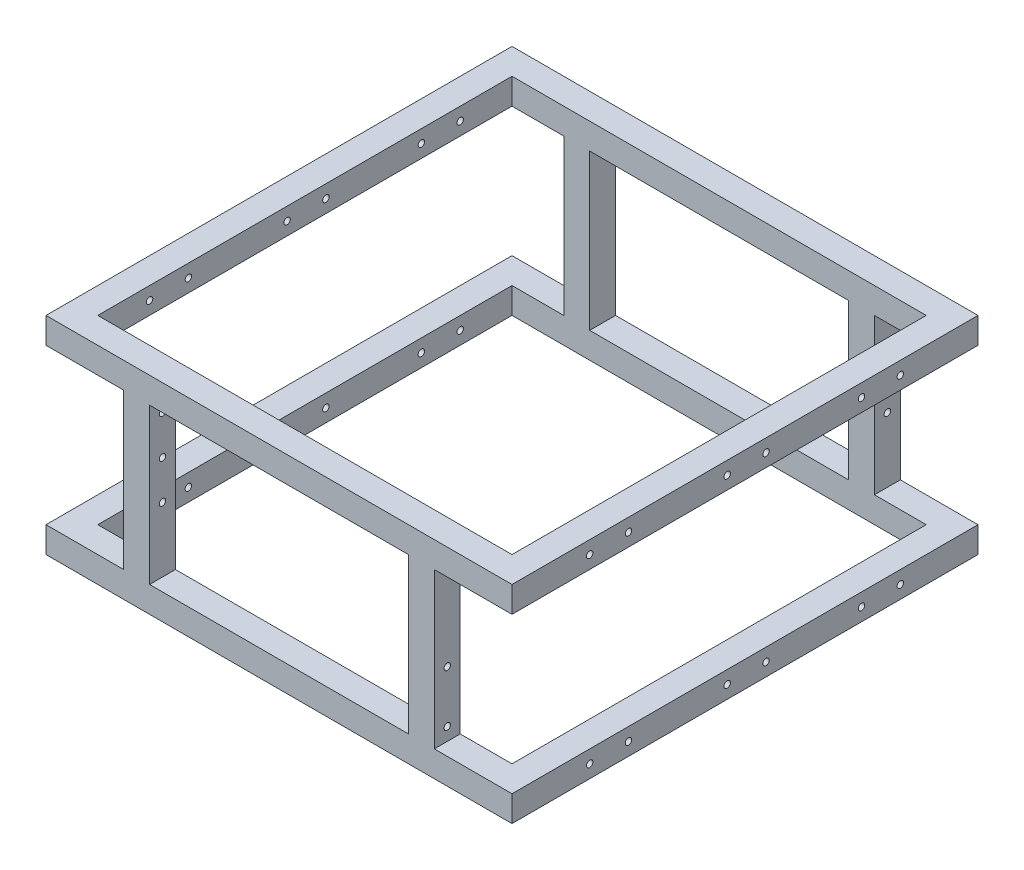
from build123d import *

# Parameters (mm, degrees)
SKETCH1_W            = 457.2
SKETCH1_H            = 457.2
SKETCH1_W_2          = 406.4
SKETCH1_H_2          = 406.4
BOSS_EXTRUDE1_DEPTH  = 203.2
CUT_EXTRUDE3_REACH   = 552.073
SKETCH2_W            = 254
SKETCH2_H            = 152.4
SKETCH2_W_2          = 76.2
SKETCH4_W            = 215.9
SKETCH4_H            = 152.4
CUT_EXTRUDE4_DEPTH   = 25.4
SKETCH6_R            = 3.175
CUT_EXTRUDE5_DEPTH   = 25.4
CUT_EXTRUDE6_START   = -25.4
SKETCH7_R            = 3.175
CUT_EXTRUDE6_DEPTH   = 25.4
CUT_EXTRUDE7_REACH   = 552.073
SKETCH8_R            = 3.175
SKETCH10_R           = 3.175
CUT_EXTRUDE8_DEPTH   = 551.072758824
LPATTERN1_COUNT      = 2
LPATTERN1_PITCH      = 38.1
LPATTERN1_COUNT_DIR2 = 2
LPATTERN1_PITCH_DIR2 = 177.8
SKETCH12_W           = 25.4
SKETCH12_H           = 152.4
CUT_EXTRUDE9_DEPTH   = 25.4
SKETCH13_W           = 25.4
SKETCH13_H           = 152.4
BOSS_EXTRUDE2_DEPTH  = 25.4
SKETCH14_R           = 3.175
CUT_EXTRUDE11_DEPTH  = 25.4


with BuildPart() as part:
    # Sketch1 → Boss-Extrude1 (new body)
    with BuildSketch(Plane(origin=(0, 0, 0), x_dir=(1, 0, 0), z_dir=(0, 1, 0))):
        Rectangle(SKETCH1_W, SKETCH1_H)
        Rectangle(SKETCH1_W_2, SKETCH1_H_2, mode=Mode.SUBTRACT)
    extrude(amount=BOSS_EXTRUDE1_DEPTH)

    # Cut-Extrude3: up to this face of the body (flat: up to its plane)
    cut_extrude3_end = Plane(part.part.faces().sort_by_distance((0, 101.6, -203.2))[0])
    # Sketch2 → Cut-Extrude3 (cut, up to the picked face)
    with BuildSketch(Plane.XY.offset(228.6), mode=Mode.PRIVATE) as cut_extrude3_sk1:
        with Locations((0, 101.6)):
            Rectangle(SKETCH2_W, SKETCH2_H)
    cut_extrude3_tool1 = split(extrude(cut_extrude3_sk1.sketch, amount=-CUT_EXTRUDE3_REACH, mode=Mode.PRIVATE), bisect_by=cut_extrude3_end, keep=Keep.BOTH, mode=Mode.PRIVATE)
    # Sketch2 → Cut-Extrude3 (cut, up to the picked face)
    with BuildSketch(Plane.XY.offset(228.6), mode=Mode.PRIVATE) as cut_extrude3_sk2:
        with Locations((190.5, 101.6)):
            Rectangle(SKETCH2_W_2, SKETCH2_H)
    cut_extrude3_tool2 = split(extrude(cut_extrude3_sk2.sketch, amount=-CUT_EXTRUDE3_REACH, mode=Mode.PRIVATE), bisect_by=cut_extrude3_end, keep=Keep.BOTH, mode=Mode.PRIVATE)
    # Sketch2 → Cut-Extrude3 (cut, up to the picked face)
    with BuildSketch(Plane.XY.offset(228.6), mode=Mode.PRIVATE) as cut_extrude3_sk3:
        with Locations((-190.5, 101.6)):
            Rectangle(SKETCH2_W_2, SKETCH2_H)
    cut_extrude3_tool3 = split(extrude(cut_extrude3_sk3.sketch, amount=-CUT_EXTRUDE3_REACH, mode=Mode.PRIVATE), bisect_by=cut_extrude3_end, keep=Keep.BOTH, mode=Mode.PRIVATE)
    add(cut_extrude3_tool1.solids().sort_by(Axis((0, 101.6, 228.6), (0, 0, -1)))[0], mode=Mode.SUBTRACT)
    add(cut_extrude3_tool2.solids().sort_by(Axis((190.5, 101.6, 228.6), (0, 0, -1)))[0], mode=Mode.SUBTRACT)
    add(cut_extrude3_tool3.solids().sort_by(Axis((-190.5, 101.6, 228.6), (0, 0, -1)))[0], mode=Mode.SUBTRACT)

    # Sketch4 → Cut-Extrude4 (cut)
    with BuildSketch(Plane(origin=(0, 0, -228.6), x_dir=(-1, 0, 0), z_dir=(0, 0, -1))):
        with Locations((120.65, 101.6)):
            Rectangle(SKETCH4_W, SKETCH4_H)
        with Locations((-120.65, 101.6)):
            Rectangle(SKETCH4_W, SKETCH4_H)
    extrude(amount=-CUT_EXTRUDE4_DEPTH, mode=Mode.SUBTRACT)

    # Sketch6 → Cut-Extrude5 (cut)
    with BuildSketch(Plane(origin=(152.4, 0, 0), x_dir=(0, 0, -1), z_dir=(1, 0, 0))):
        with Locations(Location((-215.9, 38.1, 0), (0, 0, 90))):
            Circle(SKETCH6_R)
        with Locations(Location((-215.9, 88.9, 0), (0, 0, 90))):
            Circle(SKETCH6_R)
    extrude(amount=-CUT_EXTRUDE5_DEPTH, mode=Mode.SUBTRACT)

    # Sketch7 → Cut-Extrude6 (cut)
    with BuildSketch(Plane.ZY.offset(152.4).offset(CUT_EXTRUDE6_START)):
        with Locations((215.9, 165.1)):
            Circle(SKETCH7_R)
        with Locations((215.9, 127)):
            Circle(SKETCH7_R)
        with Locations(Location((215.9, 88.9, 0), (0, 0, 90))):
            Circle(SKETCH7_R)
    extrude(amount=CUT_EXTRUDE6_DEPTH, mode=Mode.SUBTRACT)

    # Cut-Extrude7: up to this face of the body (flat: up to its plane)
    cut_extrude7_end = Plane(part.part.faces().sort_by_distance((-228.6, 190.5, 0))[0])
    # Sketch8 → Cut-Extrude7 (cut, up to the picked face)
    with BuildSketch(Plane(origin=(228.6, 0, 0), x_dir=(0, 0, -1), z_dir=(1, 0, 0)), mode=Mode.PRIVATE) as cut_extrude7_sk1:
        with Locations((152.4, 190.5)):
            Circle(SKETCH8_R)
    cut_extrude7_tool1 = split(extrude(cut_extrude7_sk1.sketch, amount=-CUT_EXTRUDE7_REACH, mode=Mode.PRIVATE), bisect_by=cut_extrude7_end, keep=Keep.BOTH, mode=Mode.PRIVATE)
    # Sketch8 → Cut-Extrude7 (cut, up to the picked face)
    with BuildSketch(Plane(origin=(228.6, 0, 0), x_dir=(0, 0, -1), z_dir=(1, 0, 0)), mode=Mode.PRIVATE) as cut_extrude7_sk2:
        with Locations((114.3, 190.5)):
            Circle(SKETCH8_R)
    cut_extrude7_tool2 = split(extrude(cut_extrude7_sk2.sketch, amount=-CUT_EXTRUDE7_REACH, mode=Mode.PRIVATE), bisect_by=cut_extrude7_end, keep=Keep.BOTH, mode=Mode.PRIVATE)
    # Sketch8 → Cut-Extrude7 (cut, up to the picked face)
    with BuildSketch(Plane(origin=(228.6, 0, 0), x_dir=(0, 0, -1), z_dir=(1, 0, 0)), mode=Mode.PRIVATE) as cut_extrude7_sk3:
        with Locations((-152.4, 190.5)):
            Circle(SKETCH8_R)
    cut_extrude7_tool3 = split(extrude(cut_extrude7_sk3.sketch, amount=-CUT_EXTRUDE7_REACH, mode=Mode.PRIVATE), bisect_by=cut_extrude7_end, keep=Keep.BOTH, mode=Mode.PRIVATE)
    # Sketch8 → Cut-Extrude7 (cut, up to the picked face)
    with BuildSketch(Plane(origin=(228.6, 0, 0), x_dir=(0, 0, -1), z_dir=(1, 0, 0)), mode=Mode.PRIVATE) as cut_extrude7_sk4:
        with Locations((-114.3, 190.5)):
            Circle(SKETCH8_R)
    cut_extrude7_tool4 = split(extrude(cut_extrude7_sk4.sketch, amount=-CUT_EXTRUDE7_REACH, mode=Mode.PRIVATE), bisect_by=cut_extrude7_end, keep=Keep.BOTH, mode=Mode.PRIVATE)
    # Sketch8 → Cut-Extrude7 (cut, up to the picked face)
    with BuildSketch(Plane(origin=(228.6, 0, 0), x_dir=(0, 0, -1), z_dir=(1, 0, 0)), mode=Mode.PRIVATE) as cut_extrude7_sk5:
        with Locations((152.4, 12.7)):
            Circle(SKETCH8_R)
    cut_extrude7_tool5 = split(extrude(cut_extrude7_sk5.sketch, amount=-CUT_EXTRUDE7_REACH, mode=Mode.PRIVATE), bisect_by=cut_extrude7_end, keep=Keep.BOTH, mode=Mode.PRIVATE)
    # Sketch8 → Cut-Extrude7 (cut, up to the picked face)
    with BuildSketch(Plane(origin=(228.6, 0, 0), x_dir=(0, 0, -1), z_dir=(1, 0, 0)), mode=Mode.PRIVATE) as cut_extrude7_sk6:
        with Locations((114.3, 12.7)):
            Circle(SKETCH8_R)
    cut_extrude7_tool6 = split(extrude(cut_extrude7_sk6.sketch, amount=-CUT_EXTRUDE7_REACH, mode=Mode.PRIVATE), bisect_by=cut_extrude7_end, keep=Keep.BOTH, mode=Mode.PRIVATE)
    # Sketch8 → Cut-Extrude7 (cut, up to the picked face)
    with BuildSketch(Plane(origin=(228.6, 0, 0), x_dir=(0, 0, -1), z_dir=(1, 0, 0)), mode=Mode.PRIVATE) as cut_extrude7_sk7:
        with Locations((-114.3, 12.7)):
            Circle(SKETCH8_R)
    cut_extrude7_tool7 = split(extrude(cut_extrude7_sk7.sketch, amount=-CUT_EXTRUDE7_REACH, mode=Mode.PRIVATE), bisect_by=cut_extrude7_end, keep=Keep.BOTH, mode=Mode.PRIVATE)
    # Sketch8 → Cut-Extrude7 (cut, up to the picked face)
    with BuildSketch(Plane(origin=(228.6, 0, 0), x_dir=(0, 0, -1), z_dir=(1, 0, 0)), mode=Mode.PRIVATE) as cut_extrude7_sk8:
        with Locations((-152.4, 12.7)):
            Circle(SKETCH8_R)
    cut_extrude7_tool8 = split(extrude(cut_extrude7_sk8.sketch, amount=-CUT_EXTRUDE7_REACH, mode=Mode.PRIVATE), bisect_by=cut_extrude7_end, keep=Keep.BOTH, mode=Mode.PRIVATE)
    add(cut_extrude7_tool1.solids().sort_by(Axis((228.6, 190.5, -152.4), (-1, 0, 0)))[0], mode=Mode.SUBTRACT)
    add(cut_extrude7_tool2.solids().sort_by(Axis((228.6, 190.5, -114.3), (-1, 0, 0)))[0], mode=Mode.SUBTRACT)
    add(cut_extrude7_tool3.solids().sort_by(Axis((228.6, 190.5, 152.4), (-1, 0, 0)))[0], mode=Mode.SUBTRACT)
    add(cut_extrude7_tool4.solids().sort_by(Axis((228.6, 190.5, 114.3), (-1, 0, 0)))[0], mode=Mode.SUBTRACT)
    add(cut_extrude7_tool5.solids().sort_by(Axis((228.6, 12.7, -152.4), (-1, 0, 0)))[0], mode=Mode.SUBTRACT)
    add(cut_extrude7_tool6.solids().sort_by(Axis((228.6, 12.7, -114.3), (-1, 0, 0)))[0], mode=Mode.SUBTRACT)
    add(cut_extrude7_tool7.solids().sort_by(Axis((228.6, 12.7, 114.3), (-1, 0, 0)))[0], mode=Mode.SUBTRACT)
    add(cut_extrude7_tool8.solids().sort_by(Axis((228.6, 12.7, 152.4), (-1, 0, 0)))[0], mode=Mode.SUBTRACT)

    # Sketch10 → Cut-Extrude8 (cut, through all)
    with BuildSketch(Plane(origin=(228.6, 0, 0), x_dir=(0, 0, -1), z_dir=(1, 0, 0))):
        with Locations((-17.4625, 190.5)):
            Circle(SKETCH10_R)
    cut_extrude8 = extrude(amount=-CUT_EXTRUDE8_DEPTH, mode=Mode.SUBTRACT)

    # LPattern1: Cut-Extrude8 2 × 2
    with Locations(*[(0, -j * LPATTERN1_PITCH_DIR2, -i * LPATTERN1_PITCH) for i in range(LPATTERN1_COUNT) for j in range(LPATTERN1_COUNT_DIR2) if (i, j) != (0, 0)]):
        add(cut_extrude8, mode=Mode.SUBTRACT)

    # Sketch12 → Cut-Extrude9 (cut)
    with BuildSketch(Plane(origin=(0, 0, -228.6), x_dir=(-1, 0, 0), z_dir=(0, 0, -1))):
        with Locations((0, 101.6)):
            Rectangle(SKETCH12_W, SKETCH12_H)
    extrude(amount=-CUT_EXTRUDE9_DEPTH, mode=Mode.SUBTRACT)

    # Sketch13 → Boss-Extrude2 (add)
    with BuildSketch(Plane(origin=(0, 0, -228.6), x_dir=(-1, 0, 0), z_dir=(0, 0, -1))):
        with Locations((-139.7, 101.6)):
            Rectangle(SKETCH13_W, SKETCH13_H)
        with Locations((139.7, 101.6)):
            Rectangle(SKETCH13_W, SKETCH13_H)
    extrude(amount=-BOSS_EXTRUDE2_DEPTH)

    # Sketch14 → Cut-Extrude11 (cut)
    with BuildSketch(Plane.ZY.offset(-127)):
        with Locations(Location((-215.9, 127, 0), (0, 0, 359.999999316))):
            Circle(SKETCH14_R)
        with Locations(Location((-215.9, 88.9, 0), (0, 0, 359.999986507))):
            Circle(SKETCH14_R)
    extrude(amount=-CUT_EXTRUDE11_DEPTH, mode=Mode.SUBTRACT)


solid = part.part
